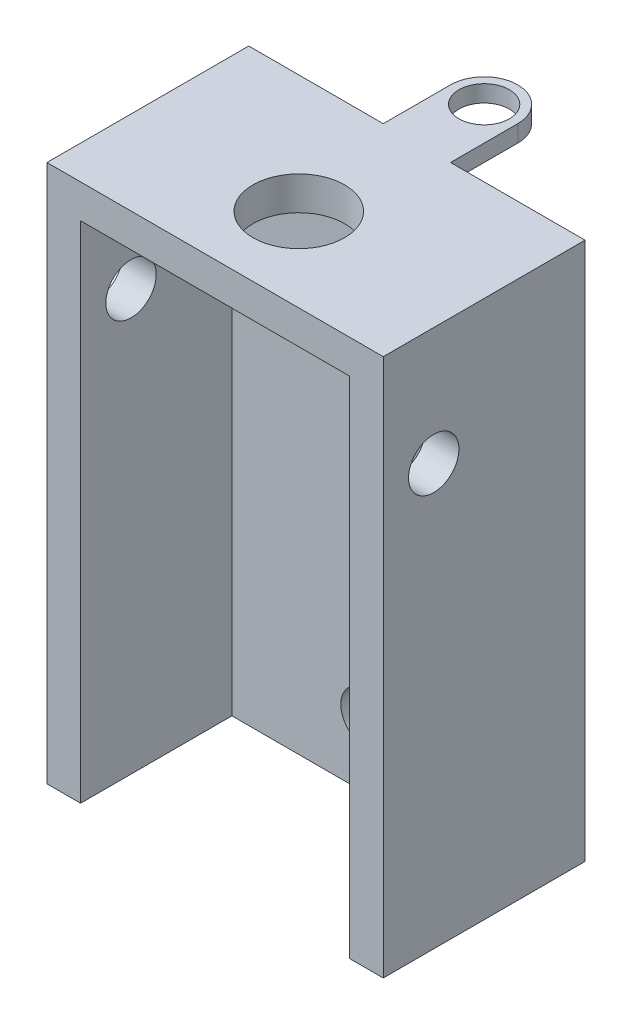
from build123d import *

# Parameters (mm, degrees)
ESQUISSE1_W                  = 20
ESQUISSE1_H                  = 32
ESQUISSE1_R                  = 1.524
BOSS_EXTRU_1_DEPTH           = 3
BOSS_EXTRU_2_DEPTH           = 12
ENL_V_MAT_EXTRU_1_DEPTH      = 23.360679775
ENL_V_MAT_EXTRU_1_DEPTH_BACK = 23.360679775
ESQUISSE3_R                  = 2.725
ENL_V_MAT_EXTRU_2_DEPTH      = 23.360679775
ENL_V_MAT_EXTRU_2_DEPTH_BACK = 23.360679775
ESQUISSE4_R                  = 1.5
ESQUISSE5_R                  = 1.5
BOSS_EXTRU_3_DEPTH           = 1


with BuildPart() as part:
    # Esquisse1 → Boss.-Extru.1 (new body)
    with BuildSketch(Plane.XY):
        Rectangle(ESQUISSE1_W, ESQUISSE1_H)
        with Locations((0, -12.162643372)):
            Circle(ESQUISSE1_R, mode=Mode.SUBTRACT)
    extrude(amount=BOSS_EXTRU_1_DEPTH)

    # Esquisse2 → Boss.-Extru.2 (add)
    with BuildSketch(Plane.XY):
        Polygon((8, -16), (10, -16), (10, 16), (-10, 16), (-10, -16), (-8, -16), (-8, 14), (8, 14), align=None)
    extrude(amount=BOSS_EXTRU_2_DEPTH)

    # Esquisse3 → Enlèv. mat.-Extru.1 (cut, two sides: drawn at the far end of the back side and taken through both)
    with BuildSketch(Plane(origin=(0, 0, 0), x_dir=(1, 0, 0), z_dir=(0, 1, 0)).offset(-ENL_V_MAT_EXTRU_1_DEPTH_BACK)):
        with Locations(Location((0, -7.024, 0), (0, 0, 270))):
            Circle(ESQUISSE3_R)
    extrude(amount=ENL_V_MAT_EXTRU_1_DEPTH + ENL_V_MAT_EXTRU_1_DEPTH_BACK, mode=Mode.SUBTRACT)

    # Esquisse4 → Enlèv. mat.-Extru.2 (cut, two sides: drawn at the far end of the back side and taken through both)
    with BuildSketch(Plane(origin=(0, 0, 0), x_dir=(0, 0, -1), z_dir=(1, 0, 0)).offset(-ENL_V_MAT_EXTRU_2_DEPTH_BACK)):
        with Locations((-9, 9)):
            Circle(ESQUISSE4_R)
    extrude(amount=ENL_V_MAT_EXTRU_2_DEPTH + ENL_V_MAT_EXTRU_2_DEPTH_BACK, mode=Mode.SUBTRACT)

    # Esquisse5 → Boss.-Extru.3 (add)
    with BuildSketch(Plane(origin=(0, 16, 0), x_dir=(1, 0, 0), z_dir=(0, 1, 0))):
        with BuildLine():
            Line((-2, 0), (-2, 4))
            ThreePointArc((-2, 4), (0, 6), (2, 4))
            Line((2, 4), (2, 0))
            Line((2, 0), (-2, 0))
        make_face()
        with Locations(Location((0, 4, 0), (0, 0, 270))):
            Circle(ESQUISSE5_R, mode=Mode.SUBTRACT)
    extrude(amount=-BOSS_EXTRU_3_DEPTH)


solid = part.part
